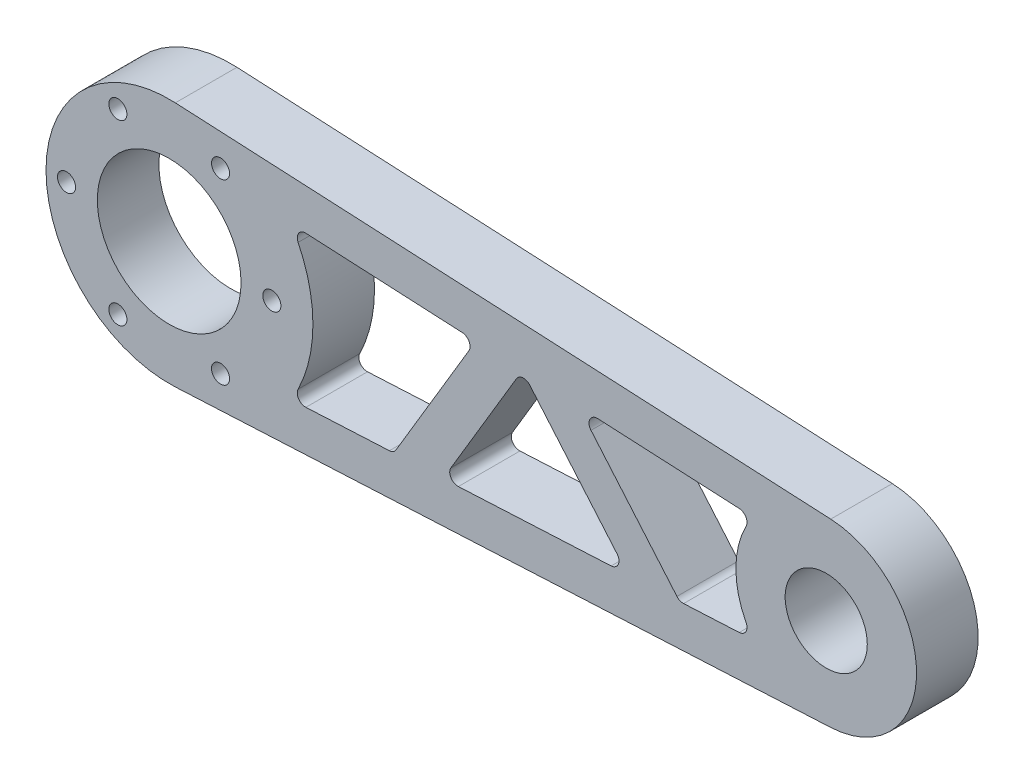
from build123d import *

# Parameters (mm, degrees)
EXTRUDE_1_DEPTH     = 15
SKETCH_2_R          = 2.2
SKETCH_2_R_2        = 10
CUT_EXTRUDE_1_DEPTH = 186.064853497
SKETCH_3_R          = 17.5
CUT_EXTRUDE_2_DEPTH = 186.064853497
FILLET_1_R          = 2


with BuildPart() as part:
    # 草图1 → 凸台-拉伸1 (new body)
    with BuildSketch(Plane.XY):
        with BuildLine():
            Line((1.5, 29.962476533), (161.1, 21.972482791))
            ThreePointArc((161.1, 21.972482791), (182, 0), (161.1, -21.972482791))
            Line((161.1, -21.972482791), (1.5, -29.962476533))
            ThreePointArc((1.5, -29.962476533), (-30, 0), (1.5, 29.962476533))
        make_face()
    extrude(amount=EXTRUDE_1_DEPTH)

    # 草图2 → 切除-拉伸1 (cut, through all)
    with BuildSketch(Plane.XY.offset(15)):
        with Locations((-25, 0)):
            Circle(SKETCH_2_R)
        with Locations((-12.5, 21.650635095)):
            Circle(SKETCH_2_R)
        with Locations((12.5, 21.650635095)):
            Circle(SKETCH_2_R)
        with Locations((25, 0)):
            Circle(SKETCH_2_R)
        with Locations((12.5, -21.650635095)):
            Circle(SKETCH_2_R)
        with Locations((-12.5, -21.650635095)):
            Circle(SKETCH_2_R)
        with Locations((160, 0)):
            Circle(SKETCH_2_R_2)
    extrude(amount=-CUT_EXTRUDE_1_DEPTH, mode=Mode.SUBTRACT)

    # 草图3 → 切除-拉伸2 (cut, through all)
    with BuildSketch(Plane.XY.offset(15)):
        Circle(SKETCH_3_R)
        with BuildLine():
            Line((29.686887248, 18.538843694), (74.686887248, 16.286025909))
            Line((74.686887248, 16.286025909), (54.686887248, -17.287278258))
            Line((54.686887248, -17.287278258), (29.686887248, -18.538843694))
            ThreePointArc((29.686887248, -18.538843694), (35, 0), (29.686887248, 18.538843694))
        make_face()
        Polygon((85.989702062, 15.720177415), (66.684590425, -16.686641834), (111.684590425, -14.433824049), align=None)
        with BuildLine():
            Line((99.713301235, 15.03313812), (142.18397437, 12.906945059))
            ThreePointArc((142.18397437, 12.906945059), (138, 0), (142.18397437, -12.906945059))
            Line((142.18397437, -12.906945059), (124.285212578, -13.803003923))
            Line((124.285212578, -13.803003923), (99.713301235, 15.03313812))
        make_face()
    extrude(amount=-CUT_EXTRUDE_2_DEPTH, mode=Mode.SUBTRACT)

    # 圆角1
    fillet_1_edges = [part.edges().sort_by_distance(p)[0] for p in [
        (124.285212578, -13.803003923, 7.5),
        (99.713301235, 15.03313812, 7.5),
        (142.18397437, 12.906945059, 7.5),
        (142.18397437, -12.906945059, 7.5),
        (85.989702062, 15.720177415, 7.5),
        (111.684590425, -14.433824049, 7.5),
        (66.684590425, -16.686641834, 7.5),
        (74.686887248, 16.286025909, 7.5),
        (54.686887248, -17.287278258, 7.5),
        (29.686887248, -18.538843694, 7.5),
        (29.686887248, 18.538843694, 7.5),
    ]]
    fillet(fillet_1_edges, radius=FILLET_1_R)


solid = part.part
